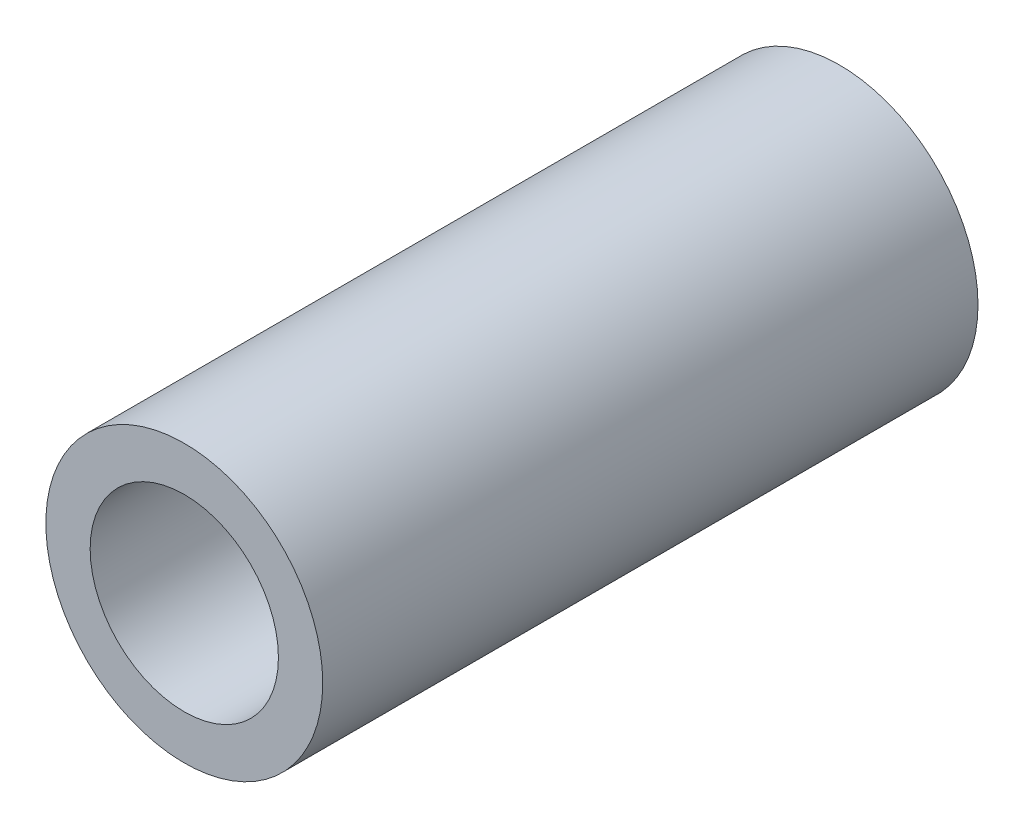
from build123d import *

# Parameters (mm, degrees)
SKETCH_1_R      = 7.5
SKETCH_1_R_2    = 5.1
EXTRUDE_1_DEPTH = 35.5


with BuildPart() as part:
    # 草图1 → 凸台-拉伸1 (new body)
    with BuildSketch(Plane.XY):
        Circle(SKETCH_1_R)
        Circle(SKETCH_1_R_2, mode=Mode.SUBTRACT)
    extrude(amount=EXTRUDE_1_DEPTH)


solid = part.part
